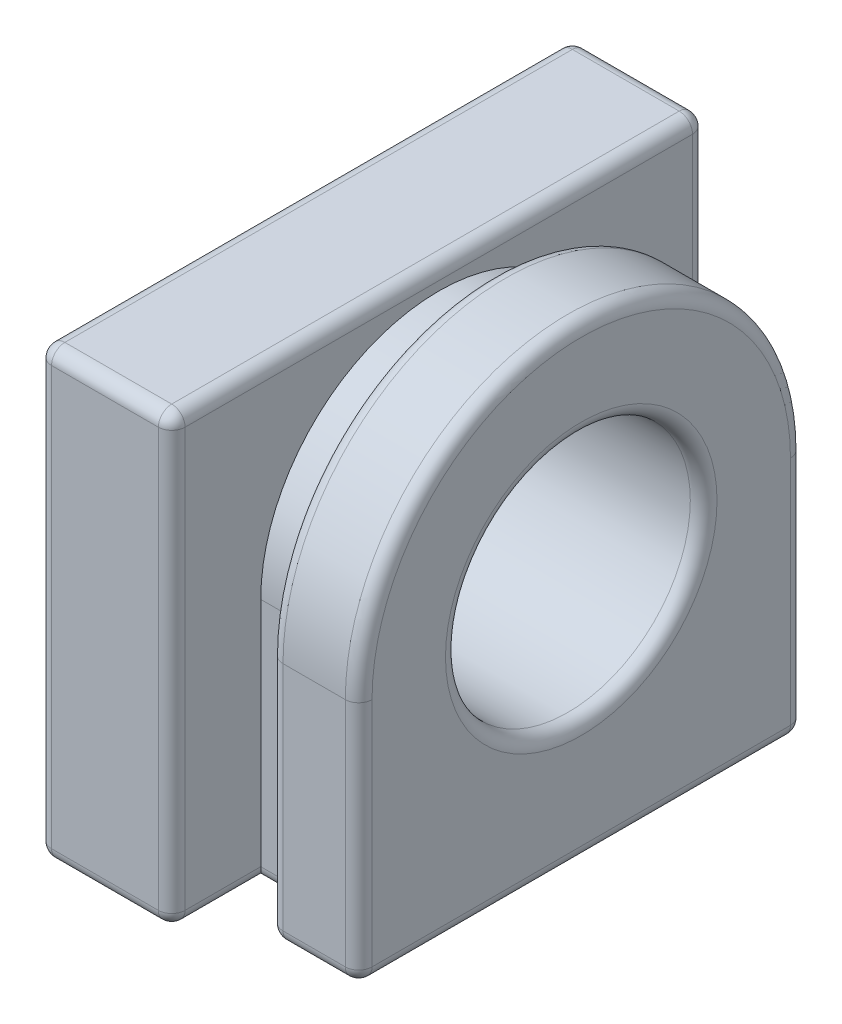
from build123d import *

# Parameters (mm, degrees)
BOSS_EXTRUDE1_DEPTH = 1.2
SKETCH2_W           = 12
SKETCH2_H           = 10
BOSS_EXTRUDE2_DEPTH = 3
BOSS_EXTRUDE3_DEPTH = 2
CUT_EXTRUDE1_REACH  = 12.232
SKETCH4_R           = 2.75
FILLET1_R           = 0.3


with BuildPart() as part:
    # Sketch1 → Boss-Extrude1 (new body)
    with BuildSketch(Plane(origin=(0, 0, 0), x_dir=(0, 0, -1), z_dir=(1, 0, 0))):
        with BuildLine():
            Line((-4, 0), (-4, -5.5))
            Line((-4, -5.5), (4, -5.5))
            Line((4, -5.5), (4, 0))
            ThreePointArc((4, 0), (0, 4), (-4, 0))
        make_face()
    extrude(amount=BOSS_EXTRUDE1_DEPTH)

    # Sketch2 → Boss-Extrude2 (add)
    with BuildSketch(Plane.ZY):
        with Locations((0, -0.5)):
            Rectangle(SKETCH2_W, SKETCH2_H)
    extrude(amount=BOSS_EXTRUDE2_DEPTH)

    # Sketch3 → Boss-Extrude3 (add)
    with BuildSketch(Plane(origin=(1.2, 0, 0), x_dir=(0, 0, -1), z_dir=(1, 0, 0))):
        with BuildLine():
            Line((-5, 0), (-5, -5.5))
            Line((-5, -5.5), (5, -5.5))
            Line((5, -5.5), (5, 0))
            ThreePointArc((5, 0), (0, 5), (-5, 0))
        make_face()
    extrude(amount=BOSS_EXTRUDE3_DEPTH)

    # Sketch4 → Cut-Extrude1 (cut, up to next)
    with BuildSketch(Plane(origin=(3.2, 0, 0), x_dir=(0, 0, -1), z_dir=(1, 0, 0)), mode=Mode.PRIVATE) as cut_extrude1_sk1:
        Circle(SKETCH4_R)
    cut_extrude1_tool1 = extrude(cut_extrude1_sk1.sketch, amount=-CUT_EXTRUDE1_REACH, mode=Mode.PRIVATE) & part.part
    add(cut_extrude1_tool1.solids().sort_by_distance((3.2, 0, 0))[0], mode=Mode.SUBTRACT)

    # Fillet1
    fillet1_edges = [part.edges().sort_by_distance(p)[0] for p in [
        (1.2, -2.75, -5),
        (1.2, -2.75, 5),
        (3.2, -2.75, -5),
        (3.2, -2.75, 5),
        (-3, 0, 2.75),
        (-3, 4.5, 0),
        (-1.5, 4.5, -6),
        (-3, -0.5, -6),
        (0, -0.5, -6),
        (0, -5.5, -5),
        (-1.5, -5.5, -6),
        (-3, -5.5, 0),
        (-3, -0.5, 6),
        (0, 4.5, 0),
        (-1.5, 4.5, 6),
        (0, -0.5, 6),
        (-1.5, -5.5, 6),
        (0, -5.5, 5),
        (0.6, -5.5, -4),
        (1.2, -5.5, -4.5),
        (0.6, -5.5, 4),
        (1.2, -5.5, 4.5),
        (2.2, -5.5, -5),
        (2.2, -5.5, 5),
        (1.2, 5, 0),
        (3.2, 0, 2.75),
        (3.2, -5.5, 0),
        (3.2, 5, 0),
    ]]
    fillet(fillet1_edges, radius=FILLET1_R)


solid = part.part
